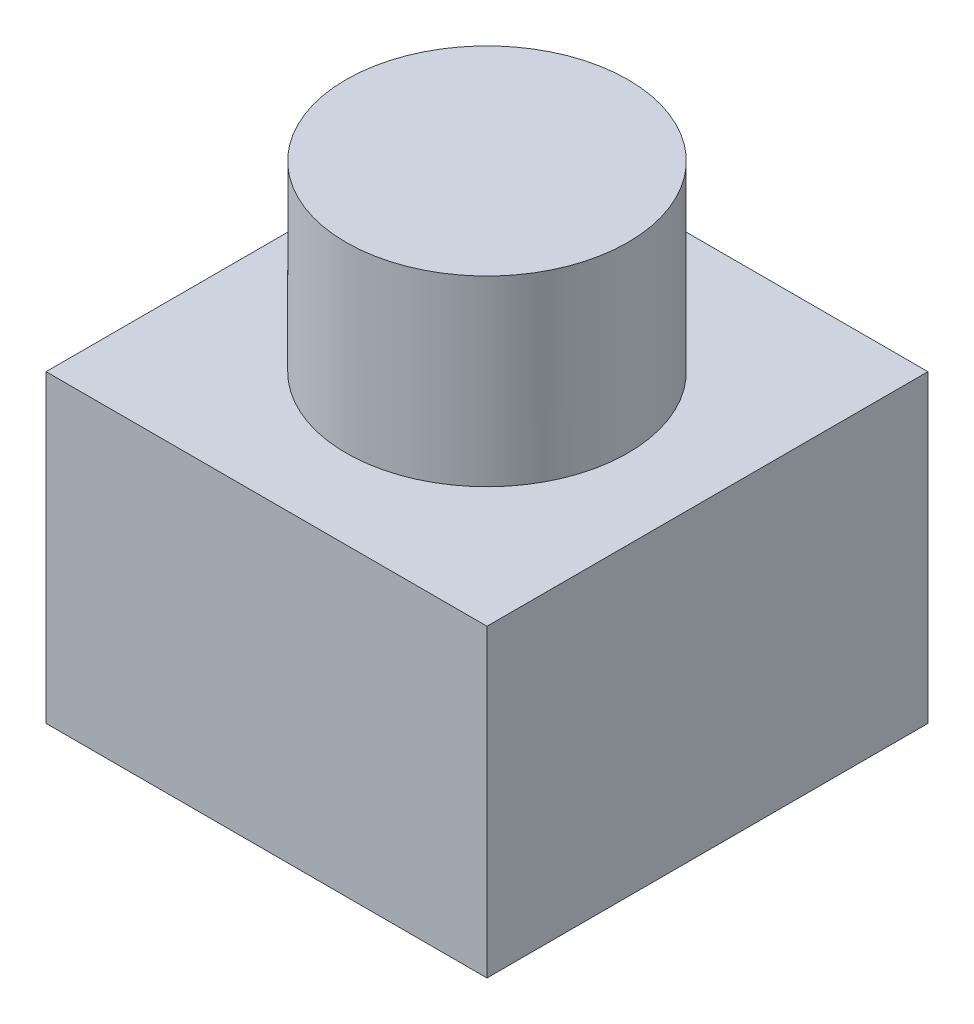
from build123d import *

# Parameters (mm, degrees)
SKETCH1_W           = 55
SKETCH1_H           = 55
BOSS_EXTRUDE1_DEPTH = 38
SKETCH2_R           = 17.583843805
BOSS_EXTRUDE2_DEPTH = 22.76


with BuildPart() as part:
    # Sketch1 → Boss-Extrude1 (new body)
    with BuildSketch(Plane(origin=(0, 0, 0), x_dir=(1, 0, 0), z_dir=(0, 1, 0))):
        Rectangle(SKETCH1_W, SKETCH1_H)
    extrude(amount=BOSS_EXTRUDE1_DEPTH)

    # Sketch2 → Boss-Extrude2 (add)
    with BuildSketch(Plane(origin=(0, 38, 0), x_dir=(1, 0, 0), z_dir=(0, 1, 0))):
        with Locations(Location((0, 0, 0), (0, 0, 90))):
            Circle(SKETCH2_R)
    extrude(amount=BOSS_EXTRUDE2_DEPTH)


solid = part.part
